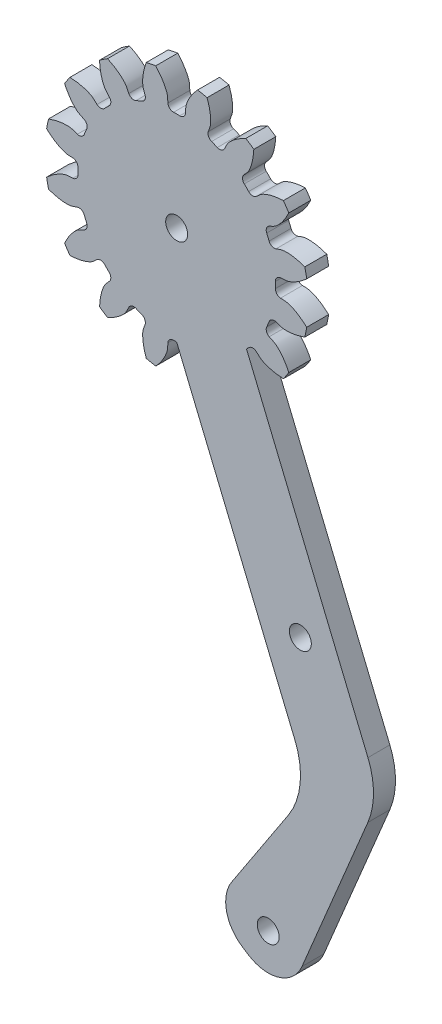
from build123d import *

# Parameters (mm, degrees)
SKETCH_1_R          = 18
LASHENA_DEPTH       = 30
CUT_EXTRUDEA_DEPTH  = 30
WWW_KYTOOL_CN_COUNT = 16
SKETCH_3_W          = 35.542909486
SKETCH_3_H          = 27
CUT_EXTRUDE_2_DEPTH = 30
SKETCH_4_R          = 1.5
CUT_EXTRUDE_3_DEPTH = 60
SKETCH_5_R          = 1.5
EXTRUDE_3_DEPTH     = 3


with BuildPart() as part:
    # 草图1 → LaShenA (new body)
    with BuildSketch(Plane.XY):
        Circle(SKETCH_1_R)
    extrude(amount=LASHENA_DEPTH)

    # SketchA → Cut-ExtrudeA (cut)
    with BuildSketch(Plane.XY.offset(30)):
        with BuildLine():
            ThreePointArc((0.423212707, 13.493364703), (0, 13.5), (-0.423212707, 13.493364703))
            ThreePointArc((-0.423212707, 13.493364703), (-0.952770902, 13.685686791), (-1.20440395, 14.18977059))
            add(Edge.make_bspline(
                [(-1.20440395, 14.18977059), (-1.226562505, 14.455224305), (-1.213843633, 14.773889884), (-1.273675597, 15.110607864), (-1.299119688, 15.21139578), (-1.321432077, 15.29109757), (-1.349914152, 15.382250837), (-1.385146673, 15.484587535), (-1.427834192, 15.597770763), (-1.478623281, 15.721446817), (-1.538159915, 15.855229004), (-1.607069773, 15.998703507), (-1.685962928, 16.151428337), (-1.775430978, 16.312934487), (-1.876046532, 16.482726463), (-1.98836201, 16.660283053), (-2.112908684, 16.845058076), (-2.250195688, 17.036481179), (-2.400709063, 17.233958676), (-2.56491084, 17.43687441), (-2.743238138, 17.644590662), (-2.936102365, 17.856449073), (-3.14388814, 18.07177164), (-3.447378451, 18.368492697), (-3.689495989, 18.585006365), (-3.858042439, 18.727457792)],
                knots=[0.122308221, 0.122308221, 0.122308221, 0.122308221, 0.250610689, 0.276296194, 0.287604067, 0.300967916, 0.316387742, 0.333863545, 0.353395324, 0.37498308, 0.398626813, 0.424326522, 0.452082207, 0.48189387, 0.513761509, 0.547685125, 0.583664717, 0.621700286, 0.661791832, 0.703939355, 0.748142854, 0.79440233, 0.842717782, 0.893089212, 1, 1, 1, 1], degree=3))
            ThreePointArc((-3.858042439, 18.727457792), (0, 19.120726106), (3.858042439, 18.727457792))
            add(Edge.make_bspline(
                [(1.20440395, 14.18977059), (1.226562505, 14.455224305), (1.213843633, 14.773889884), (1.273675597, 15.110607864), (1.299119688, 15.21139578), (1.321432077, 15.29109757), (1.349914152, 15.382250837), (1.385146673, 15.484587535), (1.427834192, 15.597770763), (1.478623281, 15.721446817), (1.538159915, 15.855229004), (1.607069773, 15.998703507), (1.685962928, 16.151428337), (1.775430978, 16.312934487), (1.876046532, 16.482726463), (1.98836201, 16.660283053), (2.112908684, 16.845058076), (2.250195688, 17.036481179), (2.400709063, 17.233958676), (2.56491084, 17.43687441), (2.743238138, 17.644590662), (2.936102365, 17.856449073), (3.14388814, 18.07177164), (3.447378451, 18.368492697), (3.689495989, 18.585006365), (3.858042439, 18.727457792)],
                knots=[0.122308221, 0.122308221, 0.122308221, 0.122308221, 0.250610689, 0.276296194, 0.287604067, 0.300967916, 0.316387742, 0.333863545, 0.353395324, 0.37498308, 0.398626813, 0.424326522, 0.452082207, 0.48189387, 0.513761509, 0.547685125, 0.583664717, 0.621700286, 0.661791832, 0.703939355, 0.748142854, 0.79440233, 0.842717782, 0.893089212, 1, 1, 1, 1], degree=3))
            ThreePointArc((1.20440395, 14.18977059), (0.952770902, 13.685686791), (0.423212707, 13.493364703))
        make_face()
    cut_extrudea = extrude(amount=-CUT_EXTRUDEA_DEPTH, mode=Mode.SUBTRACT)

    # www.KYTool.cn: Cut-ExtrudeA ×16 about axis
    www_kytool_cn_axis = Axis((0, 0, -80.9), (0, 0, 1))
    for i in range(1, WWW_KYTOOL_CN_COUNT):
        add(cut_extrudea.rotate(www_kytool_cn_axis, i * 360 / WWW_KYTOOL_CN_COUNT), mode=Mode.SUBTRACT)

    # 草图3 → 切除-拉伸2 (cut, symmetric)
    with BuildSketch(Plane(origin=(0, 0, 0), x_dir=(1, 0, 0), z_dir=(0, 1, 0))):
        with Locations((0, -13.5)):
            Rectangle(SKETCH_3_W, SKETCH_3_H)
    extrude(amount=CUT_EXTRUDE_2_DEPTH, both=True, mode=Mode.SUBTRACT)

    # 草图4 → 切除-拉伸3 (cut)
    with BuildSketch(Plane.XY.offset(30)):
        Circle(SKETCH_4_R)
    extrude(amount=-CUT_EXTRUDE_3_DEPTH, mode=Mode.SUBTRACT)

    # 草图5 → 凸台-拉伸3 (add)
    with BuildSketch(Plane.XY.offset(30)):
        with BuildLine():
            Line((15.280220873, -61.835446614), (7.518552247, -73.648578352))
            ThreePointArc((7.518552247, -73.648578352), (6.801054577, -77.407548694), (8.951700529, -80.572889581))
            Line((8.951700529, -80.572889581), (9.765341245, -81.107481911))
            ThreePointArc((9.765341245, -81.107481911), (13.973775635, -81.709971806), (17.124630908, -78.855847572))
            Line((17.124630908, -78.855847572), (26.13082512, -57.293888764))
            ThreePointArc((26.13082512, -57.293888764), (26.903397768, -53.454512274), (26.142204066, -49.612863608))
            Line((26.142204066, -49.612863608), (9.545941546, -9.545941546))
            Line((9.545941546, -9.545941546), (0, -13.5))
            Line((0, -13.5), (16.161556687, -52.517449343))
            ThreePointArc((16.161556687, -52.517449343), (16.878328365, -57.285923538), (15.280220873, -61.835446614))
        make_face()
        with Locations((16.903408741, -40.017494037)):
            Circle(SKETCH_5_R, mode=Mode.SUBTRACT)
        with Locations((12.510922719, -76.928752156)):
            Circle(SKETCH_5_R, mode=Mode.SUBTRACT)
    extrude(amount=-EXTRUDE_3_DEPTH)


solid = part.part
